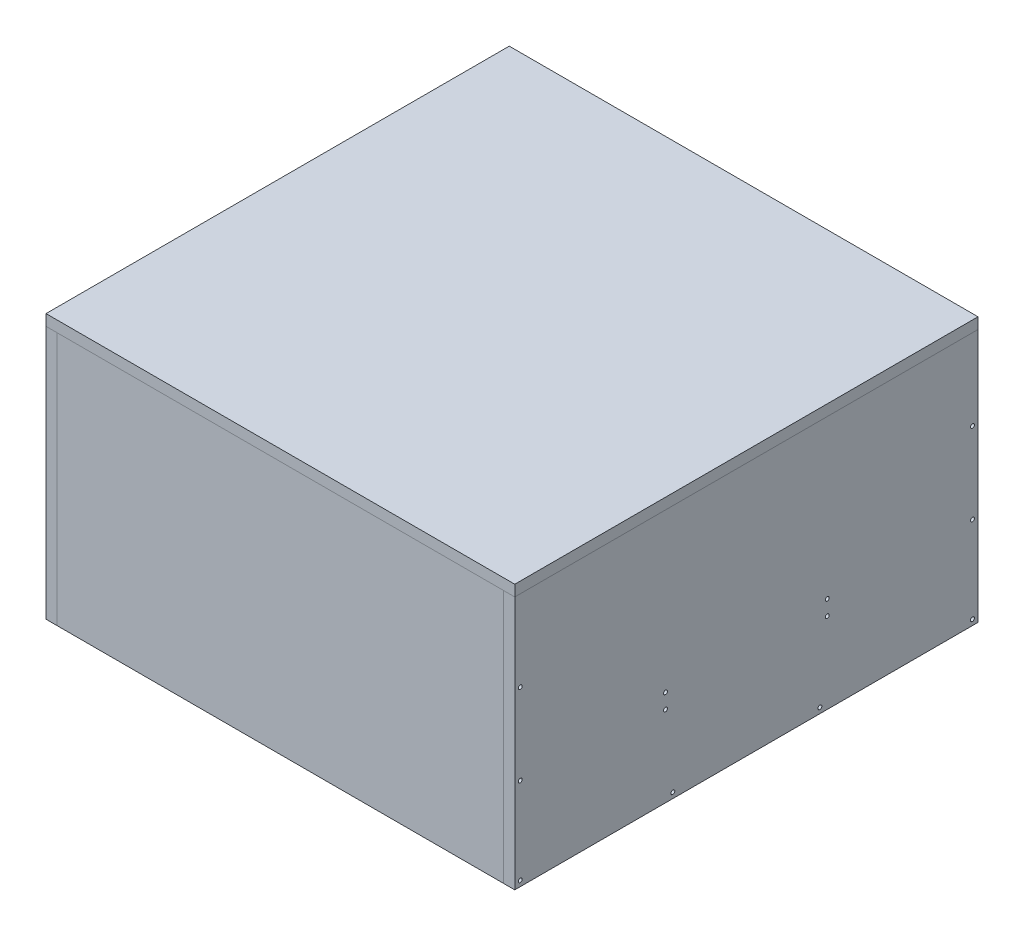
from build123d import *

# Parameters (mm, degrees)
SKETCH1_W                       = 257.175
SKETCH1_H                       = 254
BOSS_EXTRUDE1_DEPTH             = 6.35
SKETCH2_W                       = 257.175
SKETCH2_H                       = 146.05
BOSS_EXTRUDE2_DEPTH             = 6.35
SKETCH4_W                       = 266.7
SKETCH4_H                       = 146.05
BOSS_EXTRUDE3_DEPTH             = 6.35
SKETCH6_W                       = 12.7
SKETCH6_H                       = 254
BOSS_EXTRUDE4_DEPTH             = 57.15
SKETCH8_W                       = 12.7
SKETCH8_H                       = 12.7
CUT_EXTRUDE1_DEPTH              = 25.4
SKETCH11_W                      = 257.175
SKETCH11_H                      = 12.7
BOSS_EXTRUDE6_DEPTH             = 25.4
SKETCH23_W                      = 1.1303
SKETCH23_H                      = 269.875
F_4_40_TAPPED_HOLE3_AT_2_COUNT  = 2
F_4_40_TAPPED_HOLE3_AT_2_PITCH  = 46.566666667
F_4_40_TAPPED_HOLE3_AT_3_COUNT  = 2
F_4_40_TAPPED_HOLE3_AT_3_PITCH  = 96.308333333
F_4_40_TAPPED_HOLE3_AT_4_COUNT  = 2
F_4_40_TAPPED_HOLE3_AT_4_PITCH  = 130.345564143
F_4_40_TAPPED_HOLE3_AT_5_COUNT  = 2
F_4_40_TAPPED_HOLE3_AT_5_PITCH  = 197.578696604
F_4_40_TAPPED_HOLE3_AT_6_COUNT  = 2
F_4_40_TAPPED_HOLE3_AT_6_PITCH  = 98.992397374
F_4_40_TAPPED_HOLE3_AT_7_COUNT  = 2
F_4_40_TAPPED_HOLE3_AT_7_PITCH  = 94.650072396
F_4_40_TAPPED_HOLE3_AT_8_COUNT  = 2
F_4_40_TAPPED_HOLE3_AT_8_PITCH  = 182.224859824
F_4_40_TAPPED_HOLE3_AT_9_COUNT  = 2
F_4_40_TAPPED_HOLE3_AT_9_PITCH  = 184.517636206
F_4_40_TAPPED_HOLE3_AT_10_COUNT = 2
F_4_40_TAPPED_HOLE3_AT_10_PITCH = 264.481713819
F_4_40_TAPPED_HOLE3_AT_11_COUNT = 2
F_4_40_TAPPED_HOLE3_AT_11_PITCH = 260.35
F_4_40_TAPPED_HOLE3_AT_12_COUNT = 2
F_4_40_TAPPED_HOLE3_AT_12_PITCH = 277.592178509
SKETCH25_W                      = 1.1303
SKETCH25_H                      = 260.35
F_4_40_TAPPED_HOLE4_AT_2_COUNT  = 2
F_4_40_TAPPED_HOLE4_AT_2_PITCH  = 23.283333333
SKETCH26_W                      = 269.875
SKETCH26_H                      = 266.7
BOSS_EXTRUDE7_DEPTH             = 6.35


with BuildPart() as part:
    # Sketch1 → Boss-Extrude1 (new body)
    with BuildSketch(Plane(origin=(0, 0, 0), x_dir=(1, 0, 0), z_dir=(0, 1, 0))):
        with Locations((128.5875, 127)):
            Rectangle(SKETCH1_W, SKETCH1_H)
    extrude(amount=-BOSS_EXTRUDE1_DEPTH)


with BuildPart() as body_2:
    # Sketch2 → Boss-Extrude2 (new body)
    with BuildSketch(Plane.XY):
        with Locations((128.5875, 66.675)):
            Rectangle(SKETCH2_W, SKETCH2_H)
    extrude(amount=BOSS_EXTRUDE2_DEPTH)


with BuildPart() as body_3:
    # Mirror1: mirrored copy
    add(body_2.part.mirror(Plane(origin=(0, 0, -127), x_dir=(1, 0, 0), z_dir=(0, 0, -1))))


with BuildPart() as body_4:
    # Sketch4 → Boss-Extrude3 (new body)
    with BuildSketch(Plane.ZY):
        with Locations((-127, 66.675)):
            Rectangle(SKETCH4_W, SKETCH4_H)
    extrude(amount=BOSS_EXTRUDE3_DEPTH)


with BuildPart() as body_5:
    # Mirror2: mirrored copy
    add(body_4.part.mirror(Plane(origin=(128.5875, -6.35, 0), x_dir=(0, 0, 1), z_dir=(-1, 0, 0))))


with BuildPart() as body_6:
    # Sketch6 → Boss-Extrude4 (new body)
    with BuildSketch(Plane.XZ):
        with Locations((128.5875, -127)):
            Rectangle(SKETCH6_W, SKETCH6_H)
    extrude(amount=-BOSS_EXTRUDE4_DEPTH)

    # Sketch8 → Cut-Extrude1 (cut)
    with BuildSketch(Plane(origin=(0, 57.15, 0), x_dir=(-1, 0, 0), z_dir=(0, 1, 0))):
        with Locations((-128.5875, -80.433333333)):
            Rectangle(SKETCH8_W, SKETCH8_H)
        with Locations((-128.5875, -173.566666667)):
            Rectangle(SKETCH8_W, SKETCH8_H)
    extrude(amount=-CUT_EXTRUDE1_DEPTH, mode=Mode.SUBTRACT)


with BuildPart() as body_7:
    # Sketch11 → Boss-Extrude6 (new body)
    with BuildSketch(Plane(origin=(0, 31.75, 0), x_dir=(-1, 0, 0), z_dir=(0, 1, 0))):
        with Locations((-128.5875, -173.566666667)):
            Rectangle(SKETCH11_W, SKETCH11_H)
    extrude(amount=BOSS_EXTRUDE6_DEPTH)


with BuildPart() as body_8:
    # Mirror3: mirrored copy
    add(body_7.part.mirror(Plane(origin=(0, 0, -127), x_dir=(1, 0, 0), z_dir=(0, 0, -1))))


with BuildPart() as f_4_40_tapped_hole3_tool:
    # Sketch23 → #4-40 Tapped Hole3 (revolve)
    with BuildSketch(Plane(origin=(-6.35, 93.133333333, -257.175), x_dir=(0, 0, 1), z_dir=(0, 1, 0))):
        with Locations((0.56515, 134.9375)):
            Rectangle(SKETCH23_W, SKETCH23_H)
    f_4_40_tapped_hole3 = revolve(axis=Axis((-12.7, 93.133333333, -257.175), (1, 0, 0)))


with BuildPart() as body_3_1:
    add(body_3.part)

    # #4-40 Tapped Hole3: cut by f_4_40_tapped_hole3_tool
    add(f_4_40_tapped_hole3_tool.part, mode=Mode.SUBTRACT)


with BuildPart() as body_4_1:
    add(body_4.part)

    # #4-40 Tapped Hole3: cut by f_4_40_tapped_hole3_tool
    add(f_4_40_tapped_hole3_tool.part, mode=Mode.SUBTRACT)


with BuildPart() as body_5_1:
    add(body_5.part)

    # #4-40 Tapped Hole3: cut by f_4_40_tapped_hole3_tool
    add(f_4_40_tapped_hole3_tool.part, mode=Mode.SUBTRACT)


with BuildPart() as f_4_40_tapped_hole3_at_2_tool:
    # #4-40 Tapped Hole3 at 2: #4-40 Tapped Hole3 ×2
    with Locations(*[(0, -i * F_4_40_TAPPED_HOLE3_AT_2_PITCH, 0) for i in range(1, F_4_40_TAPPED_HOLE3_AT_2_COUNT)]):
        add(f_4_40_tapped_hole3)


with BuildPart() as body_3_2:
    add(body_3_1.part)

    # #4-40 Tapped Hole3 at 2: cut by f_4_40_tapped_hole3_at_2_tool
    add(f_4_40_tapped_hole3_at_2_tool.part, mode=Mode.SUBTRACT)


with BuildPart() as body_4_2:
    add(body_4_1.part)

    # #4-40 Tapped Hole3 at 2: cut by f_4_40_tapped_hole3_at_2_tool
    add(f_4_40_tapped_hole3_at_2_tool.part, mode=Mode.SUBTRACT)


with BuildPart() as body_5_2:
    add(body_5_1.part)

    # #4-40 Tapped Hole3 at 2: cut by f_4_40_tapped_hole3_at_2_tool
    add(f_4_40_tapped_hole3_at_2_tool.part, mode=Mode.SUBTRACT)


with BuildPart() as f_4_40_tapped_hole3_at_3_tool:
    # #4-40 Tapped Hole3 at 3: #4-40 Tapped Hole3 ×2
    with Locations(*[(0, -i * F_4_40_TAPPED_HOLE3_AT_3_PITCH, 0) for i in range(1, F_4_40_TAPPED_HOLE3_AT_3_COUNT)]):
        add(f_4_40_tapped_hole3)


with BuildPart() as body_3_3:
    add(body_3_2.part)

    # #4-40 Tapped Hole3 at 3: cut by f_4_40_tapped_hole3_at_3_tool
    add(f_4_40_tapped_hole3_at_3_tool.part, mode=Mode.SUBTRACT)


with BuildPart() as body_4_3:
    add(body_4_2.part)

    # #4-40 Tapped Hole3 at 3: cut by f_4_40_tapped_hole3_at_3_tool
    add(f_4_40_tapped_hole3_at_3_tool.part, mode=Mode.SUBTRACT)


with BuildPart() as body_5_3:
    add(body_5_2.part)

    # #4-40 Tapped Hole3 at 3: cut by f_4_40_tapped_hole3_at_3_tool
    add(f_4_40_tapped_hole3_at_3_tool.part, mode=Mode.SUBTRACT)


with BuildPart() as f_4_40_tapped_hole3_at_4_tool:
    # #4-40 Tapped Hole3 at 4: #4-40 Tapped Hole3 ×2
    with Locations(*[Vector(0, -0.7388692815651203, 0.6738487847873906) * (i * F_4_40_TAPPED_HOLE3_AT_4_PITCH) for i in range(1, F_4_40_TAPPED_HOLE3_AT_4_COUNT)]):
        add(f_4_40_tapped_hole3)


with BuildPart() as part_1:
    add(part.part)

    # #4-40 Tapped Hole3 at 4: cut by f_4_40_tapped_hole3_at_4_tool
    add(f_4_40_tapped_hole3_at_4_tool.part, mode=Mode.SUBTRACT)


with BuildPart() as body_4_4:
    add(body_4_3.part)

    # #4-40 Tapped Hole3 at 4: cut by f_4_40_tapped_hole3_at_4_tool
    add(f_4_40_tapped_hole3_at_4_tool.part, mode=Mode.SUBTRACT)


with BuildPart() as body_5_4:
    add(body_5_3.part)

    # #4-40 Tapped Hole3 at 4: cut by f_4_40_tapped_hole3_at_4_tool
    add(f_4_40_tapped_hole3_at_4_tool.part, mode=Mode.SUBTRACT)


with BuildPart() as f_4_40_tapped_hole3_at_5_tool:
    # #4-40 Tapped Hole3 at 5: #4-40 Tapped Hole3 ×2
    with Locations(*[Vector(0, -0.48744290244217797, 0.8731548641900504) * (i * F_4_40_TAPPED_HOLE3_AT_5_PITCH) for i in range(1, F_4_40_TAPPED_HOLE3_AT_5_COUNT)]):
        add(f_4_40_tapped_hole3)


with BuildPart() as part_2:
    add(part_1.part)

    # #4-40 Tapped Hole3 at 5: cut by f_4_40_tapped_hole3_at_5_tool
    add(f_4_40_tapped_hole3_at_5_tool.part, mode=Mode.SUBTRACT)


with BuildPart() as body_4_5:
    add(body_4_4.part)

    # #4-40 Tapped Hole3 at 5: cut by f_4_40_tapped_hole3_at_5_tool
    add(f_4_40_tapped_hole3_at_5_tool.part, mode=Mode.SUBTRACT)


with BuildPart() as body_5_5:
    add(body_5_4.part)

    # #4-40 Tapped Hole3 at 5: cut by f_4_40_tapped_hole3_at_5_tool
    add(f_4_40_tapped_hole3_at_5_tool.part, mode=Mode.SUBTRACT)


with BuildPart() as f_4_40_tapped_hole3_at_6_tool:
    # #4-40 Tapped Hole3 at 6: #4-40 Tapped Hole3 ×2
    with Locations(*[Vector(0, -0.5354081196052933, 0.8445934794093096) * (i * F_4_40_TAPPED_HOLE3_AT_6_PITCH) for i in range(1, F_4_40_TAPPED_HOLE3_AT_6_COUNT)]):
        add(f_4_40_tapped_hole3)


with BuildPart() as body_4_6:
    add(body_4_5.part)

    # #4-40 Tapped Hole3 at 6: cut by f_4_40_tapped_hole3_at_6_tool
    add(f_4_40_tapped_hole3_at_6_tool.part, mode=Mode.SUBTRACT)


with BuildPart() as body_5_6:
    add(body_5_5.part)

    # #4-40 Tapped Hole3 at 6: cut by f_4_40_tapped_hole3_at_6_tool
    add(f_4_40_tapped_hole3_at_6_tool.part, mode=Mode.SUBTRACT)


with BuildPart() as body_7_1:
    add(body_7.part)

    # #4-40 Tapped Hole3 at 6: cut by f_4_40_tapped_hole3_at_6_tool
    add(f_4_40_tapped_hole3_at_6_tool.part, mode=Mode.SUBTRACT)


with BuildPart() as f_4_40_tapped_hole3_at_7_tool:
    # #4-40 Tapped Hole3 at 7: #4-40 Tapped Hole3 ×2
    with Locations(*[Vector(0, -0.4687300517610498, 0.8833414620496899) * (i * F_4_40_TAPPED_HOLE3_AT_7_PITCH) for i in range(1, F_4_40_TAPPED_HOLE3_AT_7_COUNT)]):
        add(f_4_40_tapped_hole3)


with BuildPart() as body_4_7:
    add(body_4_6.part)

    # #4-40 Tapped Hole3 at 7: cut by f_4_40_tapped_hole3_at_7_tool
    add(f_4_40_tapped_hole3_at_7_tool.part, mode=Mode.SUBTRACT)


with BuildPart() as body_5_7:
    add(body_5_6.part)

    # #4-40 Tapped Hole3 at 7: cut by f_4_40_tapped_hole3_at_7_tool
    add(f_4_40_tapped_hole3_at_7_tool.part, mode=Mode.SUBTRACT)


with BuildPart() as body_7_2:
    add(body_7_1.part)

    # #4-40 Tapped Hole3 at 7: cut by f_4_40_tapped_hole3_at_7_tool
    add(f_4_40_tapped_hole3_at_7_tool.part, mode=Mode.SUBTRACT)


with BuildPart() as f_4_40_tapped_hole3_at_8_tool:
    # #4-40 Tapped Hole3 at 8: #4-40 Tapped Hole3 ×2
    with Locations(*[Vector(0, -0.24346476861705243, 0.9699097413894991) * (i * F_4_40_TAPPED_HOLE3_AT_8_PITCH) for i in range(1, F_4_40_TAPPED_HOLE3_AT_8_COUNT)]):
        add(f_4_40_tapped_hole3)


with BuildPart() as body_4_8:
    add(body_4_7.part)

    # #4-40 Tapped Hole3 at 8: cut by f_4_40_tapped_hole3_at_8_tool
    add(f_4_40_tapped_hole3_at_8_tool.part, mode=Mode.SUBTRACT)


with BuildPart() as body_5_8:
    add(body_5_7.part)

    # #4-40 Tapped Hole3 at 8: cut by f_4_40_tapped_hole3_at_8_tool
    add(f_4_40_tapped_hole3_at_8_tool.part, mode=Mode.SUBTRACT)


with BuildPart() as body_8_1:
    add(body_8.part)

    # #4-40 Tapped Hole3 at 8: cut by f_4_40_tapped_hole3_at_8_tool
    add(f_4_40_tapped_hole3_at_8_tool.part, mode=Mode.SUBTRACT)


with BuildPart() as f_4_40_tapped_hole3_at_9_tool:
    # #4-40 Tapped Hole3 at 9: #4-40 Tapped Hole3 ×2
    with Locations(*[Vector(0, -0.2872426420747504, 0.9578578519665206) * (i * F_4_40_TAPPED_HOLE3_AT_9_PITCH) for i in range(1, F_4_40_TAPPED_HOLE3_AT_9_COUNT)]):
        add(f_4_40_tapped_hole3)


with BuildPart() as body_4_9:
    add(body_4_8.part)

    # #4-40 Tapped Hole3 at 9: cut by f_4_40_tapped_hole3_at_9_tool
    add(f_4_40_tapped_hole3_at_9_tool.part, mode=Mode.SUBTRACT)


with BuildPart() as body_5_9:
    add(body_5_8.part)

    # #4-40 Tapped Hole3 at 9: cut by f_4_40_tapped_hole3_at_9_tool
    add(f_4_40_tapped_hole3_at_9_tool.part, mode=Mode.SUBTRACT)


with BuildPart() as body_8_2:
    add(body_8_1.part)

    # #4-40 Tapped Hole3 at 9: cut by f_4_40_tapped_hole3_at_9_tool
    add(f_4_40_tapped_hole3_at_9_tool.part, mode=Mode.SUBTRACT)


with BuildPart() as f_4_40_tapped_hole3_at_10_tool:
    # #4-40 Tapped Hole3 at 10: #4-40 Tapped Hole3 ×2
    with Locations(*[Vector(0, -0.17606762295331477, 0.9843780737844425) * (i * F_4_40_TAPPED_HOLE3_AT_10_PITCH) for i in range(1, F_4_40_TAPPED_HOLE3_AT_10_COUNT)]):
        add(f_4_40_tapped_hole3)


with BuildPart() as body_2_1:
    add(body_2.part)

    # #4-40 Tapped Hole3 at 10: cut by f_4_40_tapped_hole3_at_10_tool
    add(f_4_40_tapped_hole3_at_10_tool.part, mode=Mode.SUBTRACT)


with BuildPart() as body_4_10:
    add(body_4_9.part)

    # #4-40 Tapped Hole3 at 10: cut by f_4_40_tapped_hole3_at_10_tool
    add(f_4_40_tapped_hole3_at_10_tool.part, mode=Mode.SUBTRACT)


with BuildPart() as body_5_10:
    add(body_5_9.part)

    # #4-40 Tapped Hole3 at 10: cut by f_4_40_tapped_hole3_at_10_tool
    add(f_4_40_tapped_hole3_at_10_tool.part, mode=Mode.SUBTRACT)


with BuildPart() as f_4_40_tapped_hole3_at_11_tool:
    # #4-40 Tapped Hole3 at 11: #4-40 Tapped Hole3 ×2
    with Locations(*[(0, 0, i * F_4_40_TAPPED_HOLE3_AT_11_PITCH) for i in range(1, F_4_40_TAPPED_HOLE3_AT_11_COUNT)]):
        add(f_4_40_tapped_hole3)


with BuildPart() as body_2_2:
    add(body_2_1.part)

    # #4-40 Tapped Hole3 at 11: cut by f_4_40_tapped_hole3_at_11_tool
    add(f_4_40_tapped_hole3_at_11_tool.part, mode=Mode.SUBTRACT)


with BuildPart() as body_4_11:
    add(body_4_10.part)

    # #4-40 Tapped Hole3 at 11: cut by f_4_40_tapped_hole3_at_11_tool
    add(f_4_40_tapped_hole3_at_11_tool.part, mode=Mode.SUBTRACT)


with BuildPart() as body_5_11:
    add(body_5_10.part)

    # #4-40 Tapped Hole3 at 11: cut by f_4_40_tapped_hole3_at_11_tool
    add(f_4_40_tapped_hole3_at_11_tool.part, mode=Mode.SUBTRACT)


with BuildPart() as f_4_40_tapped_hole3_at_12_tool:
    # #4-40 Tapped Hole3 at 12: #4-40 Tapped Hole3 ×2
    with Locations(*[Vector(0, -0.34694181172747224, 0.9378866558786617) * (i * F_4_40_TAPPED_HOLE3_AT_12_PITCH) for i in range(1, F_4_40_TAPPED_HOLE3_AT_12_COUNT)]):
        add(f_4_40_tapped_hole3)


with BuildPart() as body_2_3:
    add(body_2_2.part)

    # #4-40 Tapped Hole3 at 12: cut by f_4_40_tapped_hole3_at_12_tool
    add(f_4_40_tapped_hole3_at_12_tool.part, mode=Mode.SUBTRACT)


with BuildPart() as body_4_12:
    add(body_4_11.part)

    # #4-40 Tapped Hole3 at 12: cut by f_4_40_tapped_hole3_at_12_tool
    add(f_4_40_tapped_hole3_at_12_tool.part, mode=Mode.SUBTRACT)


with BuildPart() as body_5_12:
    add(body_5_11.part)

    # #4-40 Tapped Hole3 at 12: cut by f_4_40_tapped_hole3_at_12_tool
    add(f_4_40_tapped_hole3_at_12_tool.part, mode=Mode.SUBTRACT)


with BuildPart() as f_4_40_tapped_hole4_tool:
    # Sketch25 → #4-40 Tapped Hole4 (revolve)
    with BuildSketch(Plane(origin=(128.5875, 40.216666667, 0), x_dir=(0, -1, 0), z_dir=(1, 0, 0))):
        with Locations((0.56515, 130.175)):
            Rectangle(SKETCH25_W, SKETCH25_H)
    f_4_40_tapped_hole4 = revolve(axis=Axis((128.5875, 40.216666667, 6.35), (0, 0, -1)))


with BuildPart() as body_3_4:
    add(body_3_3.part)

    # #4-40 Tapped Hole4: cut by f_4_40_tapped_hole4_tool
    add(f_4_40_tapped_hole4_tool.part, mode=Mode.SUBTRACT)


with BuildPart() as body_6_1:
    add(body_6.part)

    # #4-40 Tapped Hole4: cut by f_4_40_tapped_hole4_tool
    add(f_4_40_tapped_hole4_tool.part, mode=Mode.SUBTRACT)


with BuildPart() as body_7_3:
    add(body_7_2.part)

    # #4-40 Tapped Hole4: cut by f_4_40_tapped_hole4_tool
    add(f_4_40_tapped_hole4_tool.part, mode=Mode.SUBTRACT)


with BuildPart() as body_8_3:
    add(body_8_2.part)

    # #4-40 Tapped Hole4: cut by f_4_40_tapped_hole4_tool
    add(f_4_40_tapped_hole4_tool.part, mode=Mode.SUBTRACT)


with BuildPart() as f_4_40_tapped_hole4_at_2_tool:
    # #4-40 Tapped Hole4 at 2: #4-40 Tapped Hole4 ×2
    with Locations(*[(0, -i * F_4_40_TAPPED_HOLE4_AT_2_PITCH, 0) for i in range(1, F_4_40_TAPPED_HOLE4_AT_2_COUNT)]):
        add(f_4_40_tapped_hole4)


with BuildPart() as body_3_5:
    add(body_3_4.part)

    # #4-40 Tapped Hole4 at 2: cut by f_4_40_tapped_hole4_at_2_tool
    add(f_4_40_tapped_hole4_at_2_tool.part, mode=Mode.SUBTRACT)


with BuildPart() as body_6_2:
    add(body_6_1.part)

    # #4-40 Tapped Hole4 at 2: cut by f_4_40_tapped_hole4_at_2_tool
    add(f_4_40_tapped_hole4_at_2_tool.part, mode=Mode.SUBTRACT)


with BuildPart() as body_9:
    # Sketch26 → Boss-Extrude7 (new body)
    with BuildSketch(Plane(origin=(0, 139.7, 0), x_dir=(-1, 0, 0), z_dir=(0, 1, 0))):
        with Locations((-128.5875, -127)):
            Rectangle(SKETCH26_W, SKETCH26_H)
    extrude(amount=BOSS_EXTRUDE7_DEPTH)


solid = Compound([part_2.part, body_2_3.part, body_4_12.part, body_5_12.part, body_7_3.part, body_8_3.part, body_3_5.part, body_6_2.part, body_9.part])
